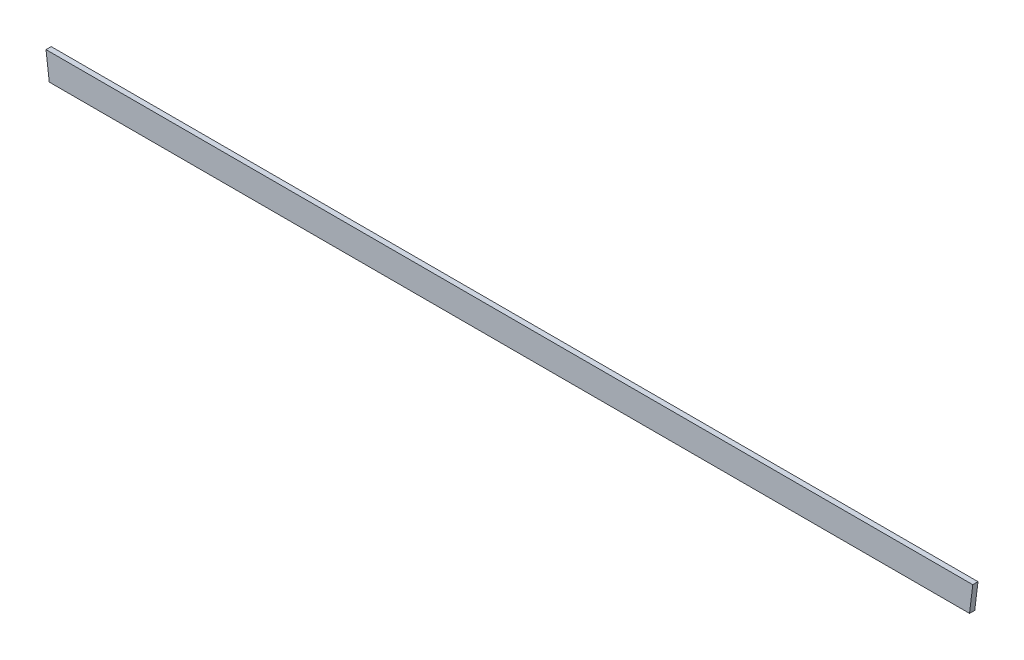
from build123d import *

# Parameters (mm, degrees)
BOSS_EXTRUDE1_DEPTH = 10


with BuildPart() as part:
    # Sketch1 → Boss-Extrude1 (new body)
    with BuildSketch(Plane.XY):
        Polygon((-881.492544306, -114.3), (881.492544306, -114.3), (887.73, -63.5), (-887.73, -63.5), align=None)
    extrude(amount=BOSS_EXTRUDE1_DEPTH)


solid = part.part
